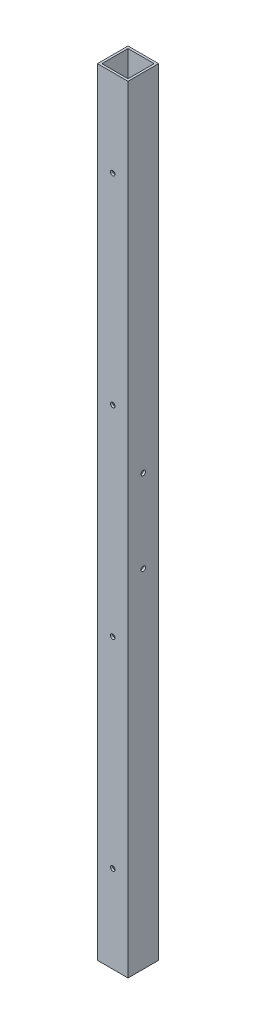
from build123d import *

# Parameters (mm, degrees)
SKETCH1_W               = 44.45
SKETCH1_H               = 44.45
SKETCH1_W_2             = 38.1
SKETCH1_H_2             = 38.1
BOSS_EXTRUDE1_DEPTH     = 1130.3
F_1_4_CLEARANCE_HOLE1_D = 6.7564
F_1_4_CLEARANCE_HOLE2_D = 6.7564


with BuildPart() as part:
    # Sketch1 → Boss-Extrude1 (new body)
    with BuildSketch(Plane(origin=(0, 0, 0), x_dir=(1, 0, 0), z_dir=(0, 1, 0))):
        Rectangle(SKETCH1_W, SKETCH1_H)
        Rectangle(SKETCH1_W_2, SKETCH1_H_2, mode=Mode.SUBTRACT)
    extrude(amount=BOSS_EXTRUDE1_DEPTH)

    # 1/4 Clearance Hole1 (through all)
    with Locations(Plane.XY.offset(22.225)):
        with Locations((0, 127), (0, 1003.3), (0, 711.2), (0, 419.1)):
            Hole(F_1_4_CLEARANCE_HOLE1_D / 2)

    # 1/4 Clearance Hole2 (through all)
    with Locations(Plane(origin=(22.225, 0, 0), x_dir=(0, 0, -1), z_dir=(1, 0, 0))):
        with Locations((0, 625.475), (0, 504.825)):
            Hole(F_1_4_CLEARANCE_HOLE2_D / 2)


solid = part.part
